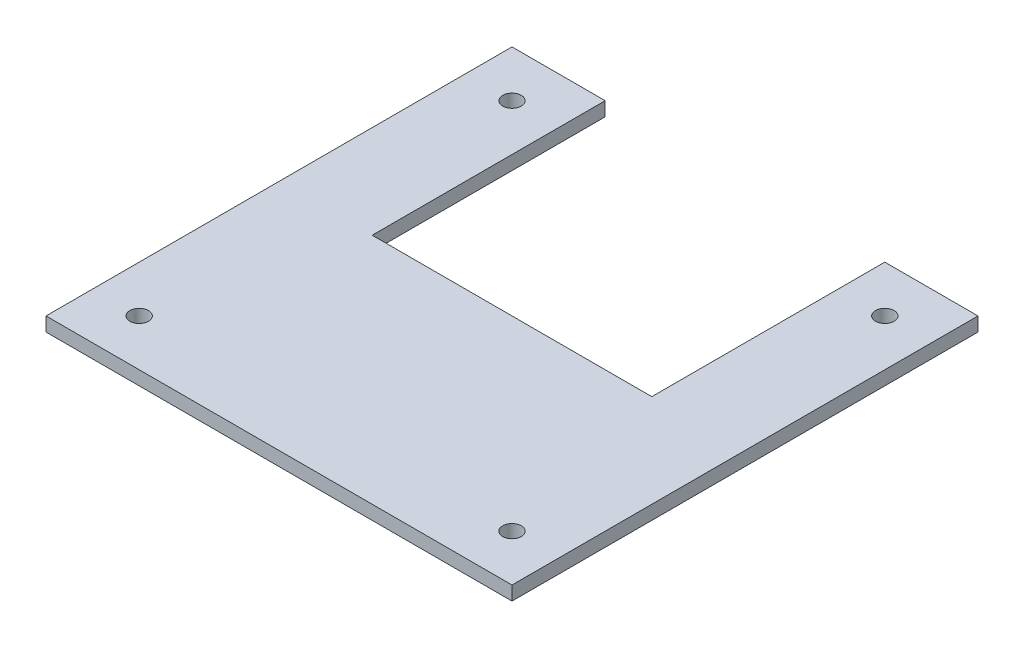
from build123d import *

# Parameters (mm, degrees)
SKETCH1_R           = 2
BOSS_EXTRUDE1_DEPTH = 3


with BuildPart() as part:
    # Sketch1 → Boss-Extrude1 (new body)
    with BuildSketch(Plane(origin=(0, 0, 0), x_dir=(1, 0, 0), z_dir=(0, 1, 0))):
        Polygon((-30, 50), (-30, 0), (30, 0), (30, 50), (50, 50), (50, -50), (-50, -50), (-50, 50), align=None)
        with Locations(Location((-40, -40, 0), (0, 0, 270))):
            Circle(SKETCH1_R, mode=Mode.SUBTRACT)
        with Locations(Location((40, -40, 0), (0, 0, 90))):
            Circle(SKETCH1_R, mode=Mode.SUBTRACT)
        with Locations(Location((40, 40, 0), (0, 0, 270))):
            Circle(SKETCH1_R, mode=Mode.SUBTRACT)
        with Locations(Location((-40, 40, 0), (0, 0, 90))):
            Circle(SKETCH1_R, mode=Mode.SUBTRACT)
    extrude(amount=BOSS_EXTRUDE1_DEPTH)


solid = part.part
